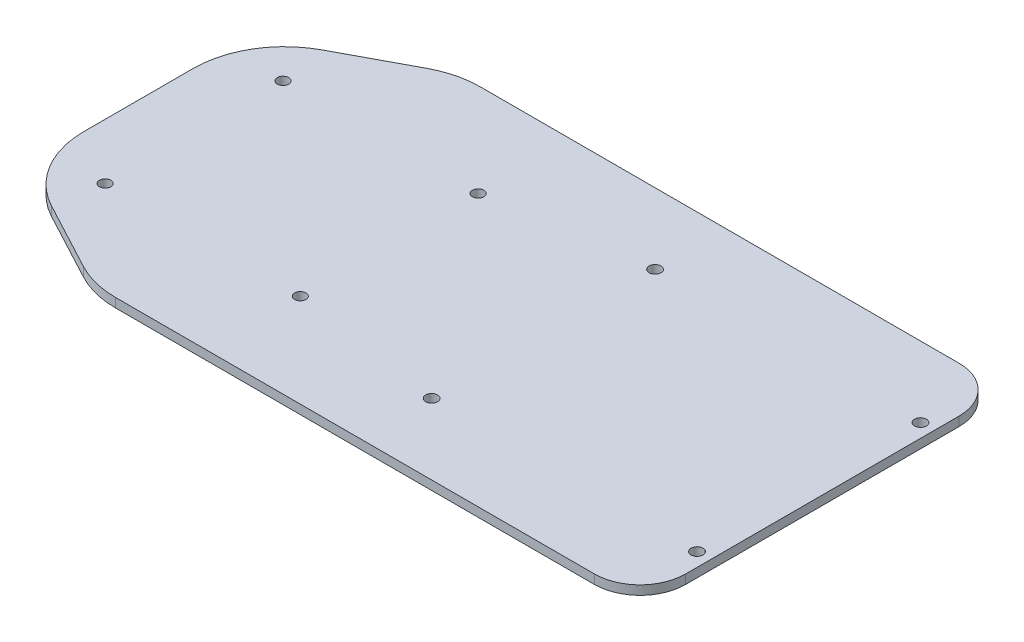
from build123d import *

# Parameters (mm, degrees)
SKETCH_1_W          = 150
SKETCH_1_H          = 80
SKETCH_1_R          = 1.25
EXTRUDE_1_DEPTH     = 2
SKETCH_2_R          = 1.3
CUT_EXTRUDE_1_DEPTH = 2
CUT_EXTRUDE_2_DEPTH = 2
FILLET_1_R          = 20
FILLET_2_R          = 10


with BuildPart() as part:
    # 草图1 → 凸台-拉伸1 (new body)
    with BuildSketch(Plane(origin=(0, 0, 0), x_dir=(1, 0, 0), z_dir=(0, 1, 0))):
        Rectangle(SKETCH_1_W, SKETCH_1_H)
        with Locations(Location((-62.8, 19.5, 0), (0, 0, 270))):
            Circle(SKETCH_1_R, mode=Mode.SUBTRACT)
        with Locations(Location((-20, 19.5, 0), (0, 0, 90))):
            Circle(SKETCH_1_R, mode=Mode.SUBTRACT)
        with Locations(Location((-20, -19.5, 0), (0, 0, 270))):
            Circle(SKETCH_1_R, mode=Mode.SUBTRACT)
        with Locations(Location((-62.8, -19.5, 0), (0, 0, 90))):
            Circle(SKETCH_1_R, mode=Mode.SUBTRACT)
    extrude(amount=EXTRUDE_1_DEPTH)

    # 草图2 → 切除-拉伸1 (cut)
    with BuildSketch(Plane(origin=(0, 2, 0), x_dir=(1, 0, 0), z_dir=(0, 1, 0))):
        with Locations(Location((13.8, 24.5, 0), (0, 0, 270))):
            Circle(SKETCH_2_R)
        with Locations(Location((72, 24.5, 0), (0, 0, 90))):
            Circle(SKETCH_2_R)
        with Locations(Location((13.8, -24.5, 0), (0, 0, 90))):
            Circle(SKETCH_2_R)
        with Locations(Location((72, -24.5, 0), (0, 0, 270))):
            Circle(SKETCH_2_R)
    extrude(amount=-CUT_EXTRUDE_1_DEPTH, mode=Mode.SUBTRACT)

    # 草图3 → 切除-拉伸2 (cut)
    with BuildSketch(Plane(origin=(0, 2, 0), x_dir=(1, 0, 0), z_dir=(0, 1, 0))):
        Polygon((-75, 40), (-45, 40), (-75, 24), align=None)
        Polygon((-45, -40), (-75, -24), (-75, -40), align=None)
    extrude(amount=-CUT_EXTRUDE_2_DEPTH, mode=Mode.SUBTRACT)

    # 圆角1
    fillet_1_edges = [part.edges().sort_by_distance(p)[0] for p in [
        (-75, 1, -24),
        (-45, 1, -40),
        (-45, 1, 40),
        (-75, 1, 24),
    ]]
    fillet(fillet_1_edges, radius=FILLET_1_R)

    # 圆角2
    fillet_2_edges = [part.edges().sort_by_distance(p)[0] for p in [
        (75, 1, 40),
        (75, 1, -40),
    ]]
    fillet(fillet_2_edges, radius=FILLET_2_R)


solid = part.part
